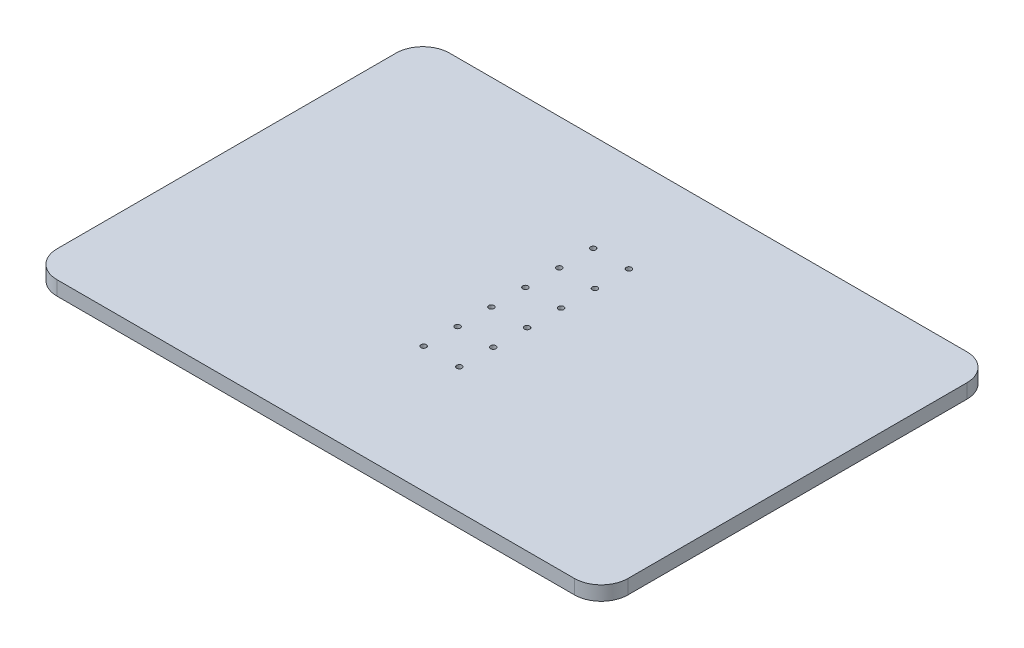
from build123d import *

# Parameters (mm, degrees)
SKETCH1_W               = 320
SKETCH1_H               = 220
BOSS_EXTRUDE1_DEPTH     = 8
FILLET1_R               = 15
CUT_EXTRUDE2_REACH      = 196.33
SKETCH3_R               = 1.5
LPATTERN2_COUNT         = 4
LPATTERN2_PITCH         = 19
LPATTERN2_COL_COUNT     = 3
LPATTERN2_COL_PITCH     = 19
MIRROR2_COPY_1_REACH    = 196.33
MIRROR2_COPY_1_SKETCH_R = 1.5
MIRROR2_COPY_2_REACH    = 196.33
MIRROR2_COPY_2_SKETCH_R = 1.5
MIRROR2_COPY_3_REACH    = 196.33
MIRROR2_COPY_3_SKETCH_R = 1.5
MIRROR2_COPY_4_REACH    = 196.33
MIRROR2_COPY_4_SKETCH_R = 1.5
MIRROR2_COPY_5_REACH    = 196.33
MIRROR2_COPY_5_SKETCH_R = 1.5


with BuildPart() as part:
    # Sketch1 → Boss-Extrude1 (new body)
    with BuildSketch(Plane(origin=(0, 0, 0), x_dir=(1, 0, 0), z_dir=(0, 1, 0))):
        Rectangle(SKETCH1_W, SKETCH1_H)
    extrude(amount=BOSS_EXTRUDE1_DEPTH)

    # Fillet1
    fillet1_edges = [part.edges().sort_by_distance(p)[0] for p in [
        (-160, 4, -110),
        (160, 4, -110),
        (160, 4, 110),
        (-160, 4, 110),
    ]]
    fillet(fillet1_edges, radius=FILLET1_R)

    # Sketch3 → Cut-Extrude2 (cut, up to next)
    with BuildSketch(Plane(origin=(0, 8, 0), x_dir=(1, 0, 0), z_dir=(0, 1, 0)), mode=Mode.PRIVATE) as cut_extrude2_sk1:
        with Locations(Location((-10, -1.5, 0), (0, 0, 270))):
            Circle(SKETCH3_R)
    cut_extrude2_tool1 = extrude(cut_extrude2_sk1.sketch, amount=-CUT_EXTRUDE2_REACH, mode=Mode.PRIVATE) & part.part
    cut_extrude2 = cut_extrude2_tool1.solids().sort_by_distance((-10, 8, 1.5))[0]
    add(cut_extrude2, mode=Mode.SUBTRACT)

    # LPattern2: Cut-Extrude2 ×4
    with Locations(*[(0, 0, -i * LPATTERN2_PITCH) for i in range(1, LPATTERN2_COUNT)]):
        add(cut_extrude2, mode=Mode.SUBTRACT)

    # LPattern2 col: Cut-Extrude2 ×3
    with Locations(*[(0, 0, i * LPATTERN2_COL_PITCH) for i in range(1, LPATTERN2_COL_COUNT)]):
        add(cut_extrude2, mode=Mode.SUBTRACT)

    # Mirror2: Cut-Extrude2 across plane
    add(cut_extrude2.mirror(Plane(origin=(0, 0, 0), x_dir=(0, 0, 1), z_dir=(1, 0, 0))), mode=Mode.SUBTRACT)

    # Mirror2 copy 1 sketch → Mirror2 copy 1 (cut, up to next)
    with BuildSketch(Plane(origin=(0, 8, -19), x_dir=(-1, 0, 0), z_dir=(0, 1, 0)), mode=Mode.PRIVATE) as mirror2_copy_1_sk1:
        with Locations((-10, 1.5)):
            Circle(MIRROR2_COPY_1_SKETCH_R)
    mirror2_copy_1_tool1 = extrude(mirror2_copy_1_sk1.sketch, amount=-MIRROR2_COPY_1_REACH, mode=Mode.PRIVATE) & part.part
    add(mirror2_copy_1_tool1.solids().sort_by_distance((10, 8, -17.5))[0], mode=Mode.SUBTRACT)

    # Mirror2 copy 2 sketch → Mirror2 copy 2 (cut, up to next)
    with BuildSketch(Plane(origin=(0, 8, -38), x_dir=(-1, 0, 0), z_dir=(0, 1, 0)), mode=Mode.PRIVATE) as mirror2_copy_2_sk1:
        with Locations((-10, 1.5)):
            Circle(MIRROR2_COPY_2_SKETCH_R)
    mirror2_copy_2_tool1 = extrude(mirror2_copy_2_sk1.sketch, amount=-MIRROR2_COPY_2_REACH, mode=Mode.PRIVATE) & part.part
    add(mirror2_copy_2_tool1.solids().sort_by_distance((10, 8, -36.5))[0], mode=Mode.SUBTRACT)

    # Mirror2 copy 3 sketch → Mirror2 copy 3 (cut, up to next)
    with BuildSketch(Plane(origin=(0, 8, -57), x_dir=(-1, 0, 0), z_dir=(0, 1, 0)), mode=Mode.PRIVATE) as mirror2_copy_3_sk1:
        with Locations((-10, 1.5)):
            Circle(MIRROR2_COPY_3_SKETCH_R)
    mirror2_copy_3_tool1 = extrude(mirror2_copy_3_sk1.sketch, amount=-MIRROR2_COPY_3_REACH, mode=Mode.PRIVATE) & part.part
    add(mirror2_copy_3_tool1.solids().sort_by_distance((10, 8, -55.5))[0], mode=Mode.SUBTRACT)

    # Mirror2 copy 4 sketch → Mirror2 copy 4 (cut, up to next)
    with BuildSketch(Plane(origin=(0, 8, 19), x_dir=(-1, 0, 0), z_dir=(0, 1, 0)), mode=Mode.PRIVATE) as mirror2_copy_4_sk1:
        with Locations((-10, 1.5)):
            Circle(MIRROR2_COPY_4_SKETCH_R)
    mirror2_copy_4_tool1 = extrude(mirror2_copy_4_sk1.sketch, amount=-MIRROR2_COPY_4_REACH, mode=Mode.PRIVATE) & part.part
    add(mirror2_copy_4_tool1.solids().sort_by_distance((10, 8, 20.5))[0], mode=Mode.SUBTRACT)

    # Mirror2 copy 5 sketch → Mirror2 copy 5 (cut, up to next)
    with BuildSketch(Plane(origin=(0, 8, 38), x_dir=(-1, 0, 0), z_dir=(0, 1, 0)), mode=Mode.PRIVATE) as mirror2_copy_5_sk1:
        with Locations((-10, 1.5)):
            Circle(MIRROR2_COPY_5_SKETCH_R)
    mirror2_copy_5_tool1 = extrude(mirror2_copy_5_sk1.sketch, amount=-MIRROR2_COPY_5_REACH, mode=Mode.PRIVATE) & part.part
    add(mirror2_copy_5_tool1.solids().sort_by_distance((10, 8, 39.5))[0], mode=Mode.SUBTRACT)


solid = part.part
